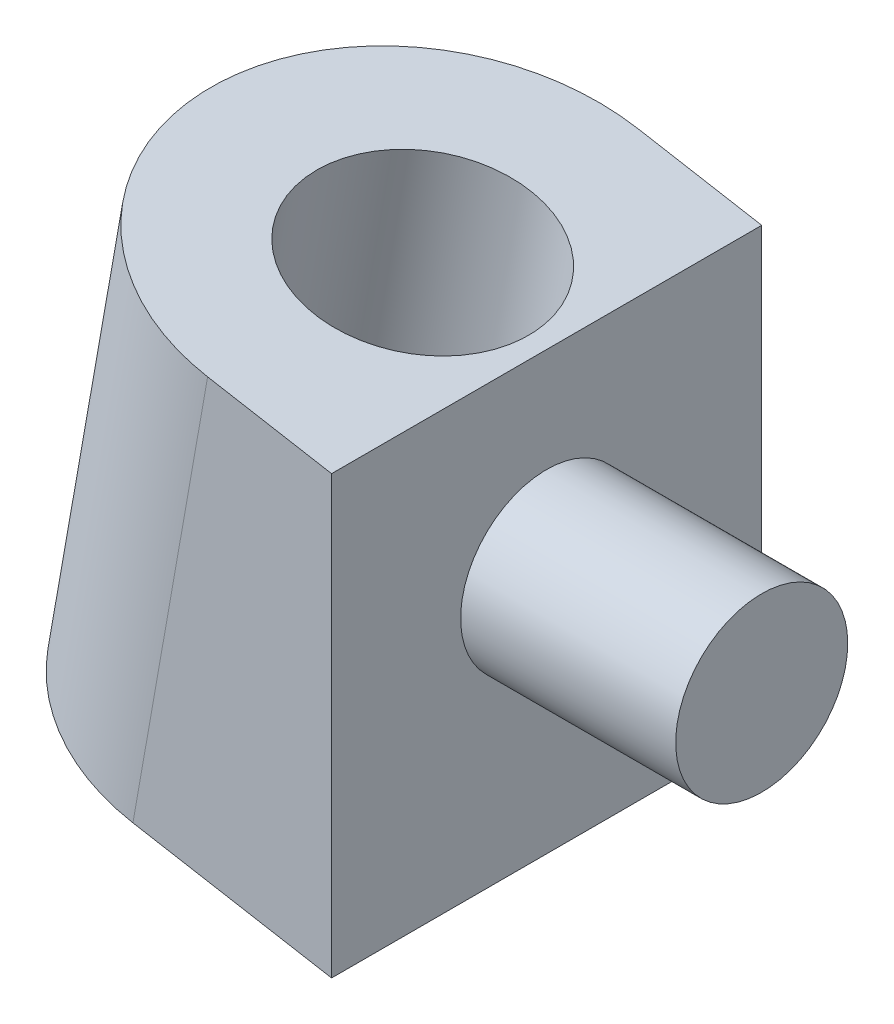
from build123d import *

# Parameters (mm, degrees)
EXTRUDE_3_DEPTH      = 10
EXTRUDE_3_DEPTH_BACK = 10
SKETCH_3_R           = 5
CUT_EXTRUDE_1_DEPTH  = 27.477518989
EXTRUDE_6_DEPTH      = 10
EXTRUDE_6_DEPTH_BACK = 10
SKETCH_9_R           = 4
EXTRUDE_8_DEPTH      = 10


with BuildPart() as part:
    # Sketch 3D_4 → ﾎﾞｽ - 押し出し3 (new, two sides: drawn at the far end of the back side and taken through both)
    with BuildSketch(Plane(origin=(0, 0, -10), x_dir=(0.24333901077648587, -0.042907233058801585, 0.9689917931466494), z_dir=(0.17364817766692725, 0.9848077530122086, 0)).offset(-EXTRUDE_3_DEPTH_BACK)):
        with BuildLine():
            Line((0, 0), (1.260173827, 4.941858145))
            Line((1.260173827, 4.941858145), (20.64000969, 0))
            Line((20.64000969, 0), (19.379835863, -4.941858145))
            ThreePointArc((19.379835863, -4.941858145), (7.218988859, -12.160847004), (0, 0))
        make_face()
    extrude(amount=EXTRUDE_3_DEPTH + EXTRUDE_3_DEPTH_BACK)

    # ｽｹｯﾁ3 → ｶｯﾄ - 押し出し1 (cut, through all)
    with BuildSketch(Plane(origin=(1.736481777, 9.84807753, 0), x_dir=(0.9848077530122086, -0.17364817766692736, 0), z_dir=(0.17364817766692736, 0.9848077530122086, 0))):
        Circle(SKETCH_3_R)
    extrude(amount=-CUT_EXTRUDE_1_DEPTH, mode=Mode.SUBTRACT)

    # Sketch 3D_9 → ﾎﾞｽ - 押し出し6 (add, two sides: drawn at the far end of the back side and taken through both)
    with BuildSketch(Plane(origin=(7.5, 8.831813764, 0), x_dir=(0, -1, 0), z_dir=(0, 0, -1)).offset(-EXTRUDE_6_DEPTH_BACK)):
        Polygon((0, 0), (20.308532238, 0), (19.565497, 4.213962236), (-0.13065806, 0.740998683), align=None)
    extrude(amount=EXTRUDE_6_DEPTH + EXTRUDE_6_DEPTH_BACK)

    # ｽｹｯﾁ9 → ﾎﾞｽ - 押し出し8 (add)
    with BuildSketch(Plane(origin=(7.5, 0, 0), x_dir=(0, 0, -1), z_dir=(1, 0, 0))):
        Circle(SKETCH_9_R)
    extrude(amount=EXTRUDE_8_DEPTH)


solid = part.part
